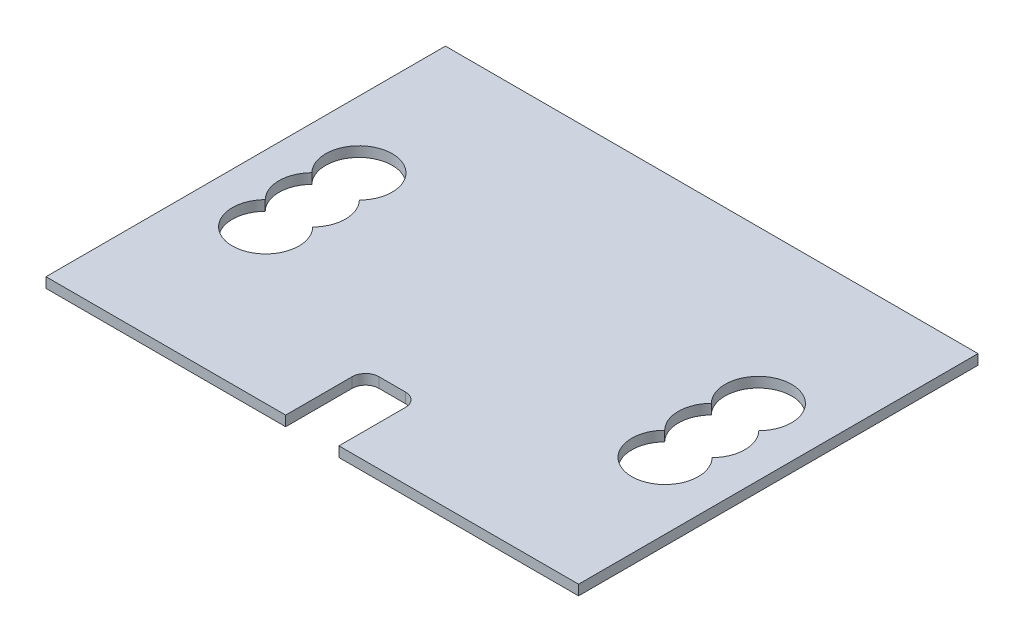
from build123d import *

# Parameters (mm, degrees)
SKETCH1_W           = 400
SKETCH1_H           = 300
BOSS_EXTRUDE1_DEPTH = 7.62
CUT_EXTRUDE1_DEPTH  = 7.62
CUT_EXTRUDE2_DEPTH  = 7.62


with BuildPart() as part:
    # Sketch1 → Boss-Extrude1 (new body)
    with BuildSketch(Plane(origin=(0, 0, 0), x_dir=(1, 0, 0), z_dir=(0, 1, 0))):
        with Locations((200, 150)):
            Rectangle(SKETCH1_W, SKETCH1_H)
    extrude(amount=BOSS_EXTRUDE1_DEPTH)

    # Sketch2 → Cut-Extrude1 (cut)
    with BuildSketch(Plane(origin=(0, 7.62, 0), x_dir=(1, 0, 0), z_dir=(0, 1, 0))):
        with BuildLine():
            ThreePointArc((32.1719512, 167.526), (25, 150), (32.1719512, 132.474))
            ThreePointArc((32.1719512, 132.474), (50, 89.948), (67.8280488, 132.474))
            ThreePointArc((67.8280488, 132.474), (75, 150), (67.8280488, 167.526))
            ThreePointArc((67.8280488, 167.526), (50, 210.052), (32.1719512, 167.526))
        make_face()
        with BuildLine():
            ThreePointArc((367.8280488, 167.526), (375, 150), (367.8280488, 132.474))
            ThreePointArc((367.8280488, 132.474), (350, 89.948), (332.1719512, 132.474))
            ThreePointArc((332.1719512, 132.474), (325, 150), (332.1719512, 167.526))
            ThreePointArc((332.1719512, 167.526), (350, 210.052), (367.8280488, 167.526))
        make_face()
    extrude(amount=-CUT_EXTRUDE1_DEPTH, mode=Mode.SUBTRACT)

    # Sketch3 → Cut-Extrude2 (cut)
    with BuildSketch(Plane(origin=(0, 7.62, 0), x_dir=(1, 0, 0), z_dir=(0, 1, 0))):
        with BuildLine():
            Line((180, 0), (220, 0))
            Line((220, 0), (220, 50))
            ThreePointArc((220, 50), (217.071067812, 57.071067812), (210, 60))
            Line((210, 60), (190, 60))
            ThreePointArc((190, 60), (182.928932188, 57.071067812), (180, 50))
            Line((180, 50), (180, 0))
        make_face()
    extrude(amount=-CUT_EXTRUDE2_DEPTH, mode=Mode.SUBTRACT)


solid = part.part
